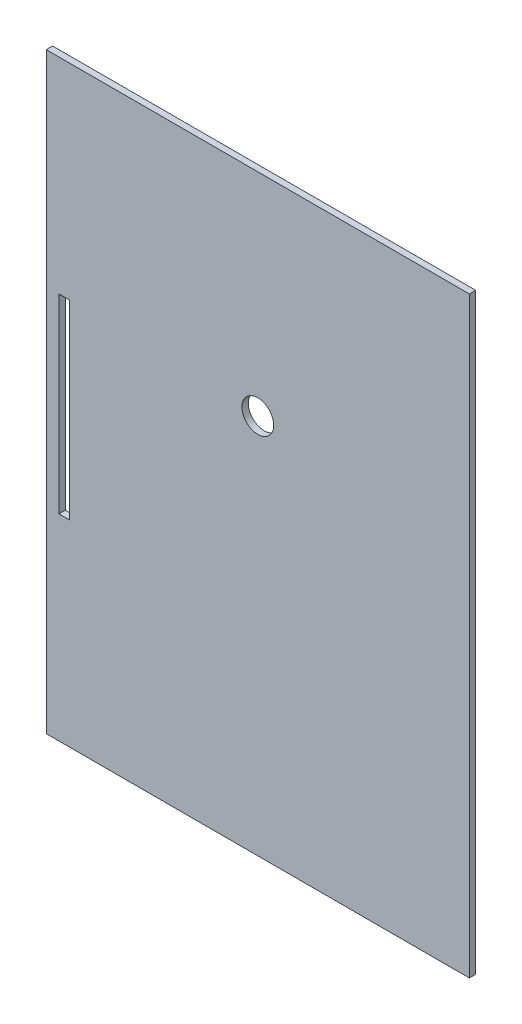
from build123d import *

# Parameters (mm, degrees)
SKETCH_1_W      = 200
SKETCH_1_H      = 280
SKETCH_1_R      = 7.5
SKETCH_1_W_2    = 5
SKETCH_1_H_2    = 90
EXTRUDE_1_DEPTH = 3


with BuildPart() as part:
    # 草圖1 → 填料-伸長1 (new body)
    with BuildSketch(Plane.XY):
        Rectangle(SKETCH_1_W, SKETCH_1_H)
        with Locations((0, 40)):
            Circle(SKETCH_1_R, mode=Mode.SUBTRACT)
        with Locations((-91.5, -2)):
            Rectangle(SKETCH_1_W_2, SKETCH_1_H_2, mode=Mode.SUBTRACT)
    extrude(amount=EXTRUDE_1_DEPTH)


solid = part.part
